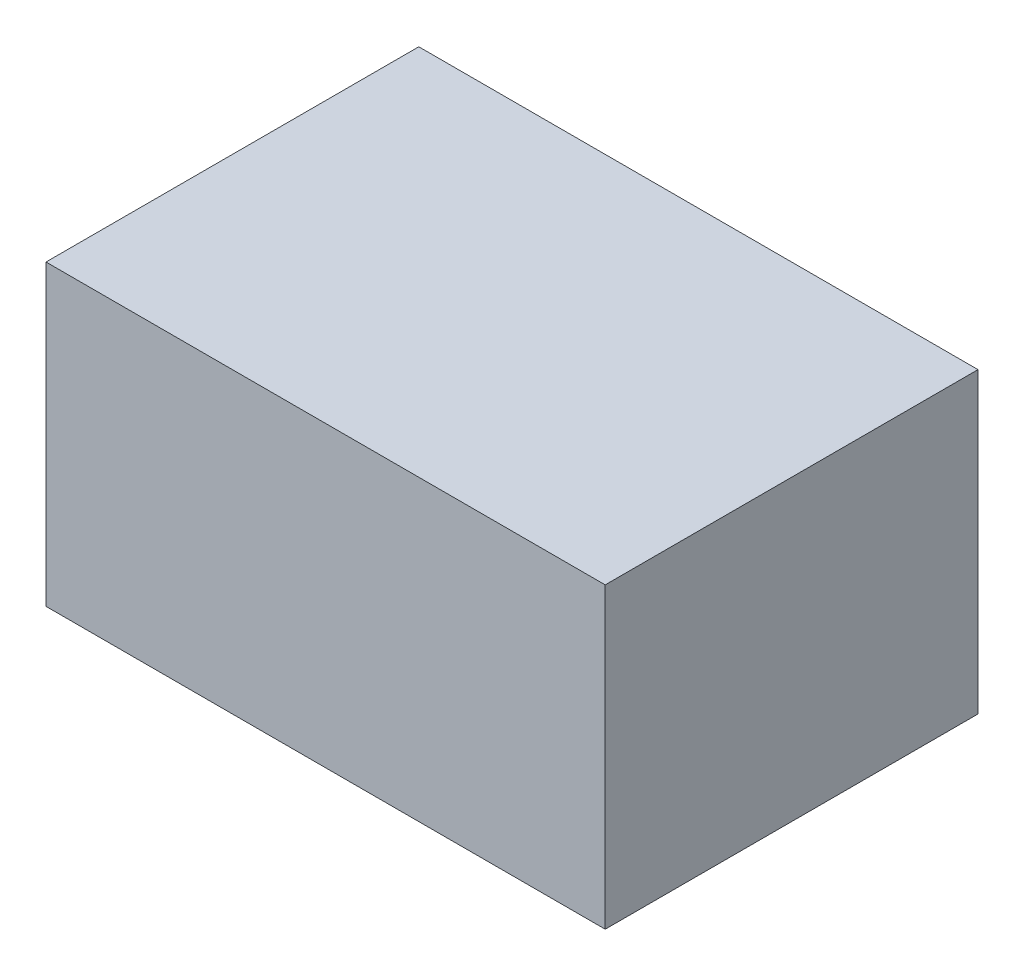
from build123d import *

# Parameters (mm, degrees)
SKETCH1_W           = 60
SKETCH1_H           = 32
BOSS_EXTRUDE1_DEPTH = 40


with BuildPart() as part:
    # Sketch1 → Boss-Extrude1 (new body)
    with BuildSketch(Plane.XY):
        Rectangle(SKETCH1_W, SKETCH1_H)
    extrude(amount=-BOSS_EXTRUDE1_DEPTH)


solid = part.part
